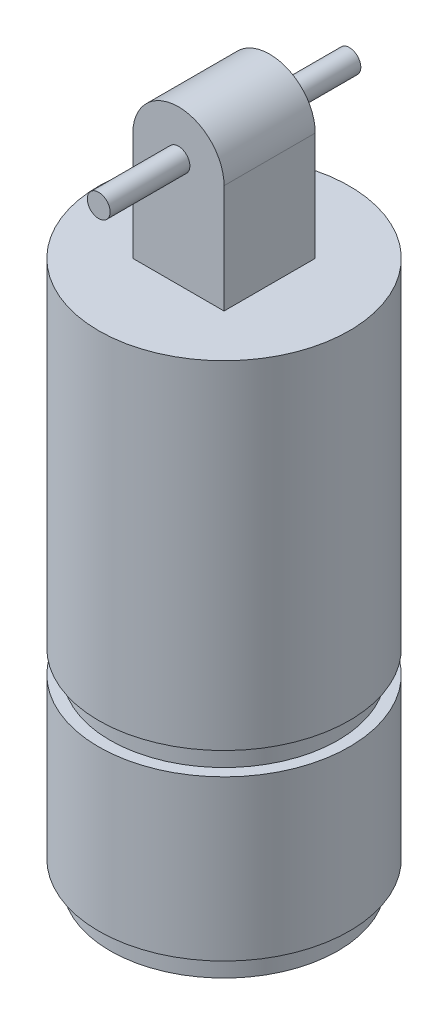
from build123d import *

# Parameters (mm, degrees)
SKETCH4_R                = 5
BOSS_EXTRUDE1_DEPTH      = 9
SKETCH5_R                = 5.5
BOSS_EXTRUDE2_DEPTH      = 3.5
BOSS_EXTRUDE3_START      = 14.8125
SKETCH6_R                = 5.5
BOSS_EXTRUDE3_DEPTH      = 14.8125
SKETCH7_R                = 4
CUT_EXTRUDE1_DEPTH       = 7
BOSS_EXTRUDE4_DEPTH      = 2
BOSS_EXTRUDE5_DEPTH      = 5.5
BOSS_EXTRUDE5_DEPTH_BACK = 5.5
SKETCH10_R               = 0.5


with BuildPart() as part:
    # Sketch4 → Boss-Extrude1 (new body)
    with BuildSketch(Plane(origin=(0, 0, 0), x_dir=(1, 0, 0), z_dir=(0, 1, 0))):
        with Locations(Location((0, 0, 0), (0, 0, 270))):
            Circle(SKETCH4_R)
    extrude(amount=BOSS_EXTRUDE1_DEPTH)

    # Sketch5 → Boss-Extrude2 (add, symmetric)
    with BuildSketch(Plane(origin=(0, 4.5, 0), x_dir=(1, 0, 0), z_dir=(0, 1, 0))):
        with Locations(Location((0, 0, 0), (0, 0, 270))):
            Circle(SKETCH5_R)
    extrude(amount=BOSS_EXTRUDE2_DEPTH, both=True)

    # Sketch6 → Boss-Extrude3 (add)
    with BuildSketch(Plane(origin=(0, 9, 0), x_dir=(1, 0, 0), z_dir=(0, 1, 0)).offset(BOSS_EXTRUDE3_START)):
        with Locations(Location((0, 0, 0), (0, 0, 270))):
            Circle(SKETCH6_R)
    extrude(amount=-BOSS_EXTRUDE3_DEPTH)

    # Sketch7 → Cut-Extrude1 (cut)
    with BuildSketch(Plane.XZ):
        with Locations(Location((0, 0, 0), (0, 0, 270))):
            Circle(SKETCH7_R)
    extrude(amount=-CUT_EXTRUDE1_DEPTH, mode=Mode.SUBTRACT)

    # Sketch8 → Boss-Extrude4 (add, symmetric)
    with BuildSketch(Plane.XY):
        with BuildLine():
            Line((-2, 23.8125), (2, 23.8125))
            Line((2, 23.8125), (2, 28.575))
            ThreePointArc((2, 28.575), (0, 30.575), (-2, 28.575))
            Line((-2, 28.575), (-2, 23.8125))
        make_face()
    extrude(amount=BOSS_EXTRUDE4_DEPTH, both=True)

    # Sketch10 → Boss-Extrude5 (add, two sides: drawn at the far end of the back side and taken through both)
    with BuildSketch(Plane.XY.offset(-BOSS_EXTRUDE5_DEPTH_BACK)):
        with Locations((0, 28.575)):
            Circle(SKETCH10_R)
    extrude(amount=BOSS_EXTRUDE5_DEPTH + BOSS_EXTRUDE5_DEPTH_BACK)


solid = part.part
